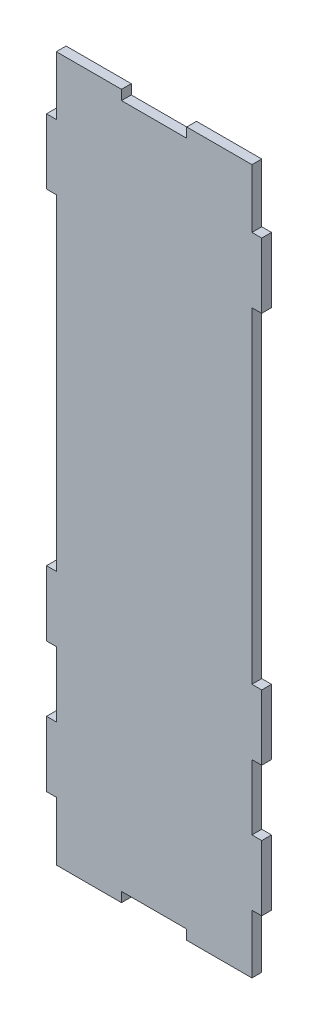
from build123d import *

# Parameters (mm, degrees)
BOSS_EXTRUDE1_DEPTH = 3


with BuildPart() as part:
    # Sketch1 → Boss-Extrude1 (new body)
    with BuildSketch(Plane.XY):
        Polygon((0, 0), (0, 100), (-3, 100), (-3, 120), (0, 120), (0, 138), (20, 138), (20, 135), (40, 135), (40, 138), (60, 138), (60, 120), (63, 120), (63, 100), (60, 100), (60, 0), (63, 0), (63, -20), (60, -20), (60, -40), (63, -40), (63, -60), (60, -60), (60, -78), (40, -78), (40, -75), (20, -75), (20, -78), (0, -78), (0, -60), (-3, -60), (-3, -40), (0, -40), (0, -20), (-3, -20), (-3, 0), align=None)
    extrude(amount=BOSS_EXTRUDE1_DEPTH)


solid = part.part
